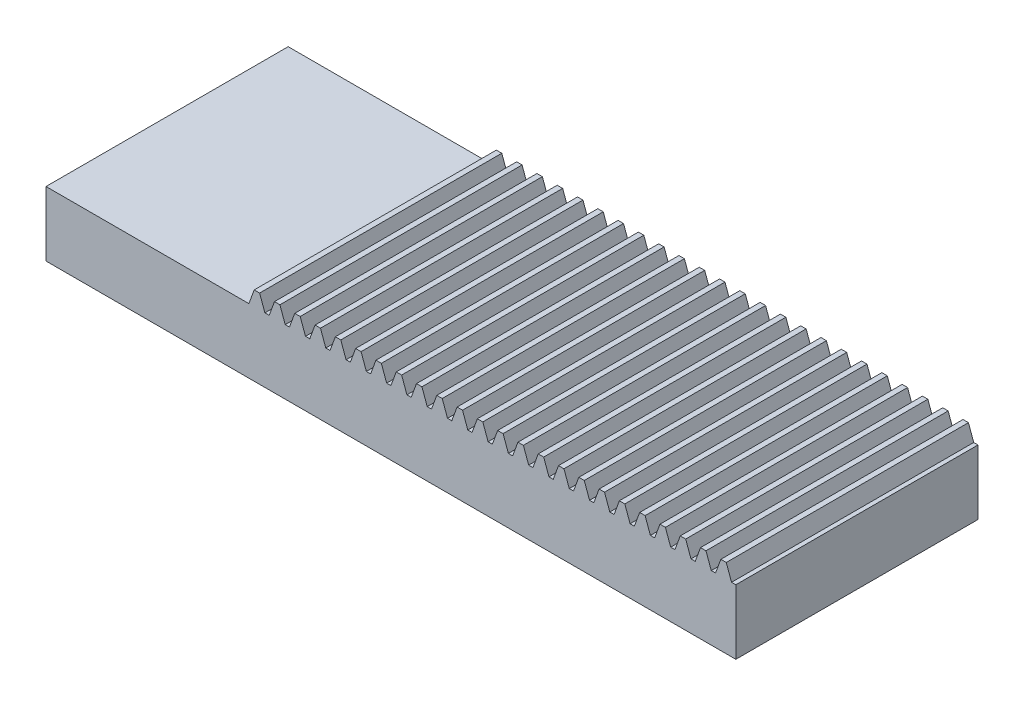
from build123d import *

# Parameters (mm, degrees)
SKETCH1_W           = 85.451320178
SKETCH1_H           = 8
EXTRUDE1_DEPTH      = 30
EXTRUDE2_DEPTH      = 30
LPATTERN1_COUNT     = 34
LPATTERN1_PITCH     = 2.513274123
SKETCH_1_W          = 24.951320178
SKETCH_1_H          = 8.70222752
CUT_EXTRUDE_1_DEPTH = 40


with BuildPart() as part:
    # Sketch1 → Extrude1 (new body)
    with BuildSketch(Plane.XY):
        with Locations((42.725660089, -4)):
            Rectangle(SKETCH1_W, SKETCH1_H)
    extrude(amount=EXTRUDE1_DEPTH)

    # Sketch2 → Extrude2 (add)
    with BuildSketch(Plane.XY.offset(30)):
        Polygon((0, 0), (0.655146422, 1.8), (1.329431108, 1.8), (1.98457753, 0), align=None)
    extrude2 = extrude(amount=-EXTRUDE2_DEPTH)

    # LPattern1: Extrude2 ×34
    with Locations(*[(i * LPATTERN1_PITCH, 0, 0) for i in range(1, LPATTERN1_COUNT)]):
        add(extrude2)

    # 草图1 → 切除-拉伸1 (cut)
    with BuildSketch(Plane.XY.offset(30)):
        with Locations((12.475660089, 4.35111376)):
            Rectangle(SKETCH_1_W, SKETCH_1_H)
    extrude(amount=-CUT_EXTRUDE_1_DEPTH, mode=Mode.SUBTRACT)


solid = part.part
